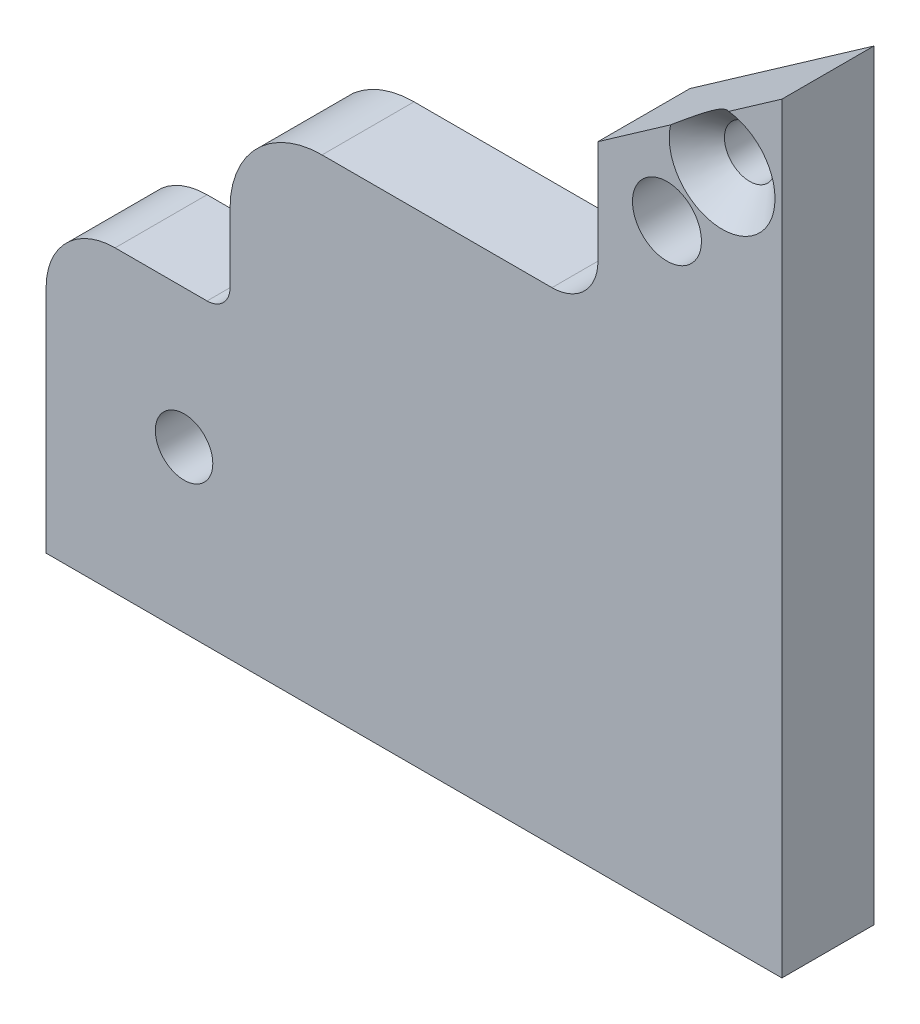
from build123d import *

# Parameters (mm, degrees)
SKETCH1_W                     = 32
SKETCH1_H                     = 33.10166
BOSS_EXTRUDE1_DEPTH           = 4
SKETCH2_W                     = 8
SKETCH2_H                     = 20.10166
CUT_EXTRUDE1_DEPTH            = 45.803049827
SKETCH3_W                     = 16
SKETCH3_H                     = 12.10166
CUT_EXTRUDE2_DEPTH            = 45.803049827
DRAFT1_ANGLE                  = -35.000000002
F_3_0_3_DIAMETER_HOLE1_D      = 3
CSK_FOR_M3_SFHCS1_D           = 2.2
CSK_FOR_M3_SFHCS1_DEPTH       = 9.5
CSK_FOR_M3_SFHCS1_CSINK_D     = 4.6
CSK_FOR_M3_SFHCS1_CSINK_ANGLE = 90
CSK_FOR_M3_SFHCS1_TIP         = 0.660946681
M3X0_5_TAPPED_HOLE2_D         = 2.5
M3X0_5_TAPPED_HOLE2_DEPTH     = 7.5
M3X0_5_TAPPED_HOLE2_TIP       = 0.751075774
FILLET1_R                     = 1
FILLET2_R                     = 2
FILLET3_R                     = 3
FILLET4_R                     = 4
M3X0_5_TAPPED_HOLE1_D         = 2.5


with BuildPart() as part:
    # Sketch1 → Boss-Extrude1 (new body)
    with BuildSketch(Plane(origin=(0, 0, 0), x_dir=(-1, 0, 0), z_dir=(0, 0, -1))):
        with Locations((-16, 14.550830306)):
            Rectangle(SKETCH1_W, SKETCH1_H)
    extrude(amount=-BOSS_EXTRUDE1_DEPTH)

    # Sketch2 → Cut-Extrude1 (cut, through all)
    with BuildSketch(Plane.XY.offset(4)):
        with Locations((4, 21.050830306)):
            Rectangle(SKETCH2_W, SKETCH2_H)
    extrude(amount=-CUT_EXTRUDE1_DEPTH, mode=Mode.SUBTRACT)

    # Sketch3 → Cut-Extrude2 (cut, through all)
    with BuildSketch(Plane.XY.offset(4)):
        with Locations((16, 25.050830306)):
            Rectangle(SKETCH3_W, SKETCH3_H)
    extrude(amount=-CUT_EXTRUDE2_DEPTH, mode=Mode.SUBTRACT)

    # Draft1
    draft1_faces = [part.faces().sort_by_distance(p)[0] for p in [
        (28, 31.101660306, 2),
    ]]
    draft(draft1_faces, Plane(origin=(32, 31.101660306, 4), x_dir=(0, 1, 0), z_dir=(1, 0, 0)), DRAFT1_ANGLE)

    # Ø3.0 (3) Diameter Hole1 (through all)
    with Locations(Plane.XY.offset(4)):
        with Locations((27, 24)):
            Hole(F_3_0_3_DIAMETER_HOLE1_D / 2)

    # CSK for M3 SFHCS1
    with Locations(Plane.XY.offset(4)):
        with Locations((29.4, 27.2)):
            CounterSinkHole(CSK_FOR_M3_SFHCS1_D / 2, CSK_FOR_M3_SFHCS1_CSINK_D / 2, depth=CSK_FOR_M3_SFHCS1_DEPTH, counter_sink_angle=CSK_FOR_M3_SFHCS1_CSINK_ANGLE)
            with Locations((0, 0, -(CSK_FOR_M3_SFHCS1_DEPTH + CSK_FOR_M3_SFHCS1_TIP / 2))):  # 118° drill point
                Cone(0, CSK_FOR_M3_SFHCS1_D / 2, CSK_FOR_M3_SFHCS1_TIP, mode=Mode.SUBTRACT)

    # M3x0.5 Tapped Hole2
    with Locations(Plane(origin=(0, -1.999999694, 0), x_dir=(-1, 0, 0), z_dir=(0, -1, 0))):
        with Locations((-10, -2), (-19.5, -2), (-29, -2)):
            Hole(M3X0_5_TAPPED_HOLE2_D / 2, depth=M3X0_5_TAPPED_HOLE2_DEPTH)
            with Locations((0, 0, -(M3X0_5_TAPPED_HOLE2_DEPTH + M3X0_5_TAPPED_HOLE2_TIP / 2))):  # 118° drill point
                Cone(0, M3X0_5_TAPPED_HOLE2_D / 2, M3X0_5_TAPPED_HOLE2_TIP, mode=Mode.SUBTRACT)

    # Fillet1
    fillet1_edges = [part.edges().sort_by_distance(p)[0] for p in [
        (8, 11.000000306, 2),
    ]]
    fillet(fillet1_edges, radius=FILLET1_R)

    # Fillet2
    fillet2_edges = [part.edges().sort_by_distance(p)[0] for p in [
        (24, 19.000000306, 2),
    ]]
    fillet(fillet2_edges, radius=FILLET2_R)

    # Fillet3
    fillet3_edges = [part.edges().sort_by_distance(p)[0] for p in [
        (0, 11.000000306, 2),
    ]]
    fillet(fillet3_edges, radius=FILLET3_R)

    # Fillet4
    fillet4_edges = [part.edges().sort_by_distance(p)[0] for p in [
        (8, 19.000000306, 2),
    ]]
    fillet(fillet4_edges, radius=FILLET4_R)

    # M3x0.5 Tapped Hole1 (through all)
    with Locations(Plane(origin=(6, 5.000000306, 4), x_dir=(1, 0, 0), z_dir=(0, 0, 1))):
        with Locations((0, 0)):
            Hole(M3X0_5_TAPPED_HOLE1_D / 2)


solid = part.part
